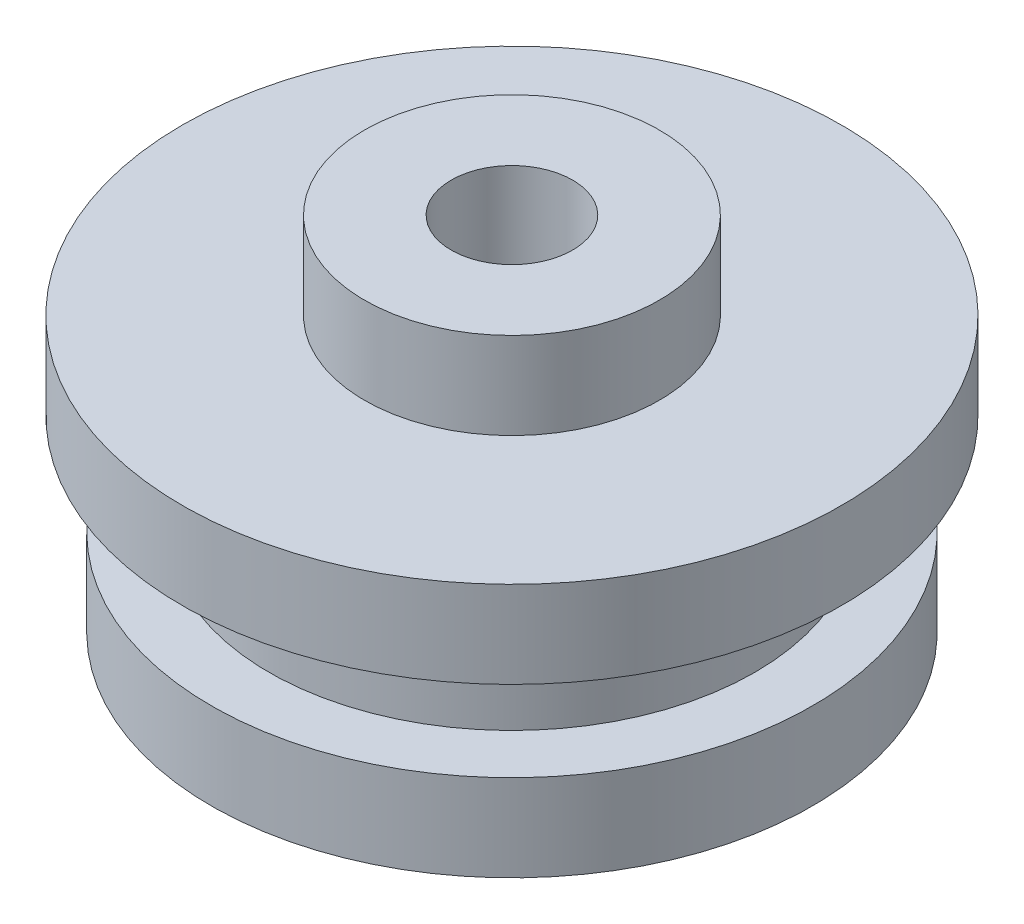
from build123d import *


with BuildPart() as part:
    # Esquisse1 → Révolution1 (revolve)
    with BuildSketch(Plane.XY):
        Polygon((0, 0), (0, -12.5), (-8.3, -12.5), (-8.3, -9.5), (-6.3, -9.5), (-6.3, -6), (-9.3, -6), (-9.3, -3), (-3, -3), (-3, 0), align=None)
    revolve(axis=Axis((2.1, 0, 0), (0, -1, 0)))


solid = part.part
